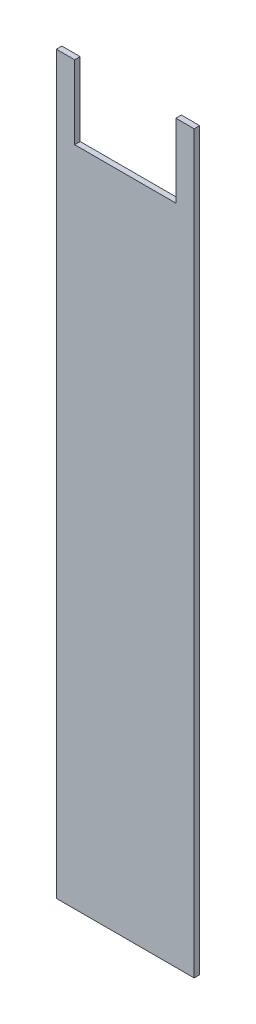
from build123d import *

# Parameters (mm, degrees)
P_IDAT_VYSUNUT_M1_DEPTH = 3


with BuildPart() as part:
    # Skica1 → Přidat vysunutím1 (new body)
    with BuildSketch(Plane.XY):
        Polygon((0, 0), (0, 400), (10, 400), (10, 360), (65, 360), (65, 400), (75, 400), (75, 0), align=None)
    extrude(amount=P_IDAT_VYSUNUT_M1_DEPTH)


solid = part.part
